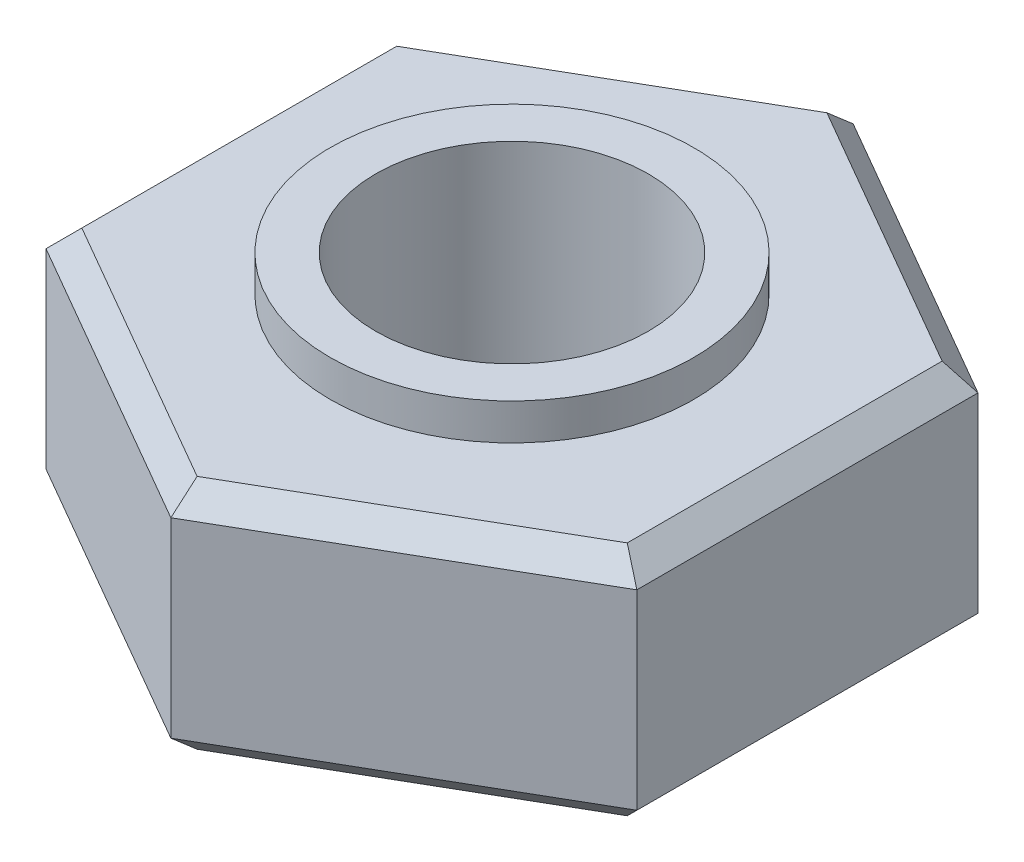
from build123d import *

# Parameters (mm, degrees)
SKETCH1_R           = 3
BOSS_EXTRUDE1_DEPTH = 6
SKETCH3_R           = 4
CUT_EXTRUDE1_DEPTH  = 0.8
CHAMFER1_SIZE       = 0.5


with BuildPart() as part:
    # Sketch1 → Boss-Extrude1 (new body)
    with BuildSketch(Plane(origin=(0, 0, 0), x_dir=(1, 0, 0), z_dir=(0, 1, 0))):
        Polygon((0, -7.505553499), (6.5, -3.75277675), (6.5, 3.75277675), (0, 7.505553499), (-6.5, 3.75277675), (-6.5, -3.75277675), align=None)
        with Locations(Location((0, 0, 0), (0, 0, 270))):
            Circle(SKETCH1_R, mode=Mode.SUBTRACT)
    extrude(amount=BOSS_EXTRUDE1_DEPTH)

    # Sketch3 → Cut-Extrude1 (cut)
    with BuildSketch(Plane(origin=(0, 6, 0), x_dir=(1, 0, 0), z_dir=(0, 1, 0))):
        Polygon((-6.5, -3.75277675), (0, -7.505553499), (6.5, -3.75277675), (6.5, 3.75277675), (0, 7.505553499), (-6.5, 3.75277675), align=None)
        with Locations(Location((0, 0, 0), (0, 0, 270))):
            Circle(SKETCH3_R, mode=Mode.SUBTRACT)
    extrude(amount=-CUT_EXTRUDE1_DEPTH, mode=Mode.SUBTRACT)

    # Chamfer1
    chamfer1_edges = [part.edges().sort_by_distance(p)[0] for p in [
        (-6.5, 5.2, 0),
        (-3.25, 5.2, -5.629165125),
        (3.25, 5.2, -5.629165125),
        (6.5, 5.2, 0),
        (3.25, 5.2, 5.629165125),
        (-3.25, 5.2, 5.629165125),
        (-6.5, 0, 0),
        (-3.25, 0, -5.629165125),
        (3.25, 0, -5.629165125),
        (6.5, 0, 0),
        (3.25, 0, 5.629165125),
        (-3.25, 0, 5.629165125),
    ]]
    chamfer(chamfer1_edges, length=CHAMFER1_SIZE)


solid = part.part
